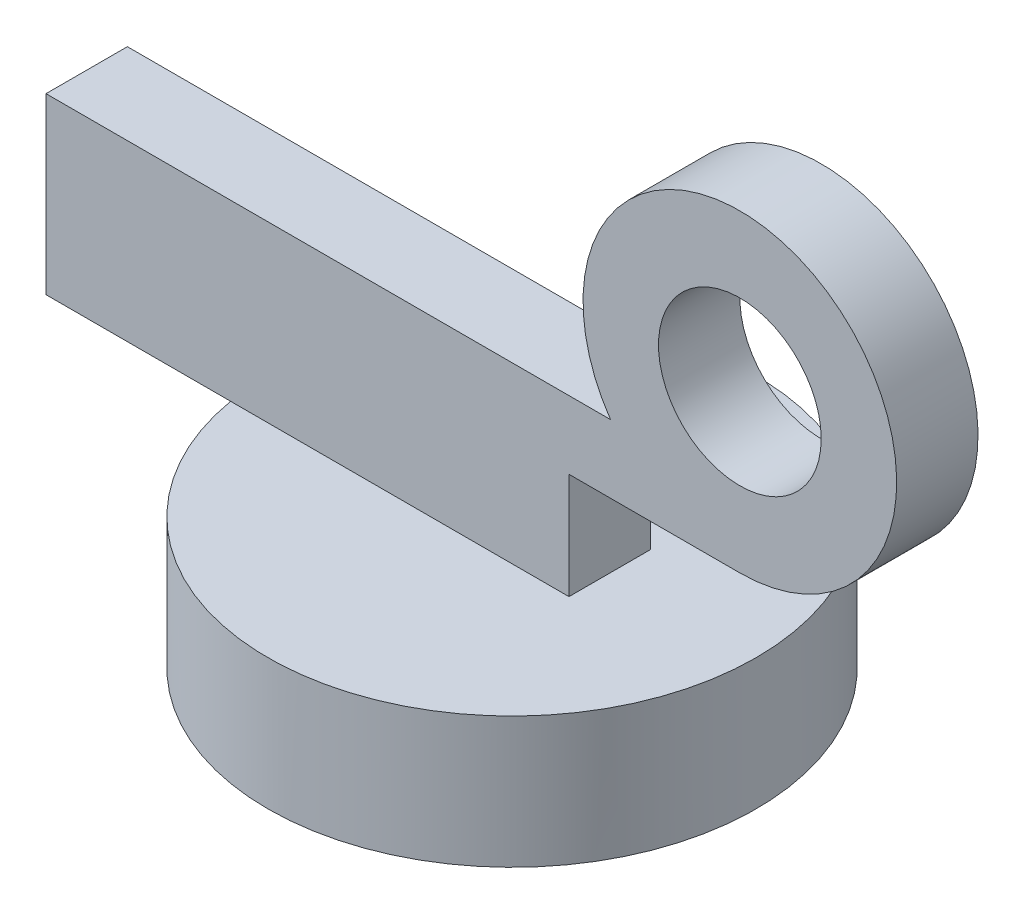
from build123d import *

# Parameters (mm, degrees)
SKETCH1_R                = 300
BOSS_EXTRUDE1_DEPTH      = 161
SKETCH2_R                = 192.75
SKETCH2_R_2              = 100
SKETCH2_W                = 642.75
SKETCH2_H                = 214
BOSS_EXTRUDE2_DEPTH      = 50
SKETCH3_R                = 75
CUT_EXTRUDE1_DEPTH       = 40
SKETCH4_R                = 100
CUT_EXTRUDE2_DEPTH       = 40
BOSS_EXTRUDE3_REACH      = 982.366
BOSS_EXTRUDE3_END_RADIUS = 192.75
SKETCH5_W                = 100
SKETCH5_H                = 83.75


with BuildPart() as part:
    # Sketch1 → Boss-Extrude1 (new body)
    with BuildSketch(Plane(origin=(0, 0, 0), x_dir=(1, 0, 0), z_dir=(0, 1, 0))):
        with Locations(Location((0, 0, 0), (0, 0, 270))):
            Circle(SKETCH1_R)
    extrude(amount=BOSS_EXTRUDE1_DEPTH)

    # Sketch2 → Boss-Extrude2 (add, symmetric)
    # profile 1 of 2: a face of its own
    with BuildSketch(Plane.XY):
        with Locations((330, 484)):
            Circle(SKETCH2_R)
        with Locations((330, 484)):
            Circle(SKETCH2_R_2, mode=Mode.SUBTRACT)
    # profile 2 of 2: a face of its own
    with BuildSketch(Plane.XY):
        with Locations((-201.375, 268)):
            Rectangle(SKETCH2_W, SKETCH2_H)
    extrude(amount=BOSS_EXTRUDE2_DEPTH, both=True)


with BuildPart() as boss_extrude2_piece_1:
    # of the separate pieces the step leaves, piece 1, a body of its own (boss_extrude2_pieces)
    add(part.part.solids().sort_by_distance((0, 0, 300))[0])

    # Sketch3 → Cut-Extrude1 (cut)
    with BuildSketch(Plane.XZ):
        with Locations(Location((0, 0, 0), (0, 0, 270))):
            Circle(SKETCH3_R)
    extrude(amount=-CUT_EXTRUDE1_DEPTH, mode=Mode.SUBTRACT)

    # Sketch4 → Cut-Extrude2 (cut)
    with BuildSketch(Plane.XZ.offset(-40)):
        with Locations(Location((0, 0, 0), (0, 0, 270))):
            Circle(SKETCH4_R)
    extrude(amount=-CUT_EXTRUDE2_DEPTH, mode=Mode.SUBTRACT)



with BuildPart() as boss_extrude2_piece_2:
    # of the separate pieces the step leaves, piece 2, a body of its own (boss_extrude2_pieces)
    add(part.part.solids().sort_by_distance((522.75, 484, -50))[0])


with BuildPart() as boss_extrude2_piece_1_1:
    add(boss_extrude2_piece_1.part)

    add(boss_extrude2_piece_2.part)  # Boss-Extrude3 merges Boss-Extrude2 piece 2
    # Boss-Extrude3: up to this cylinder (the profile starts outside it)
    boss_extrude3_end = Plane(origin=(330, 484, 0), z_dir=(0, 0, -1)) * Cylinder(BOSS_EXTRUDE3_END_RADIUS, 2351.232, mode=Mode.PRIVATE)
    # Sketch5 → Boss-Extrude3 (add, up to the surface)
    with BuildSketch(Plane(origin=(120, 0, 0), x_dir=(0, 0, -1), z_dir=(1, 0, 0)), mode=Mode.PRIVATE) as boss_extrude3_sk1:
        with Locations((0, 333.125)):
            Rectangle(SKETCH5_W, SKETCH5_H)
    boss_extrude3_tool1 = extrude(boss_extrude3_sk1.sketch, amount=BOSS_EXTRUDE3_REACH, mode=Mode.PRIVATE) - boss_extrude3_end
    add(boss_extrude3_tool1.solids().sort_by_distance((120, 333.125, 0))[0])


solid = boss_extrude2_piece_1_1.part
